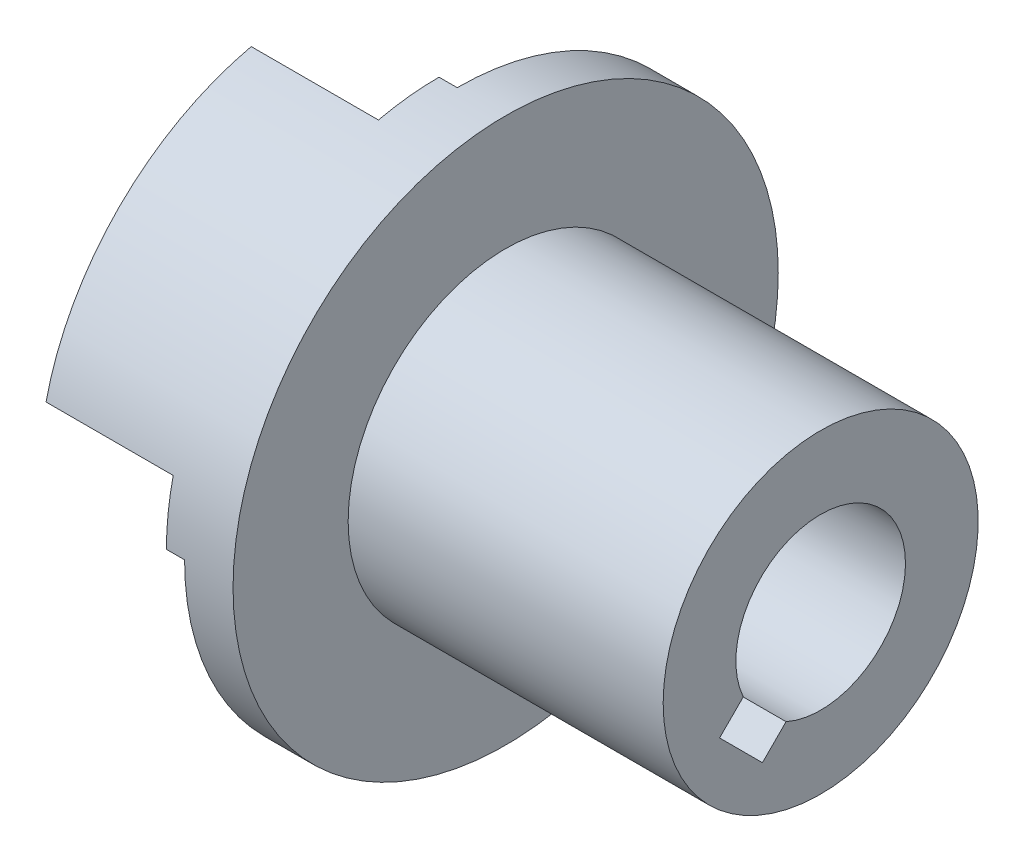
from build123d import *
from build123d.topology import SkipClean

# Parameters (mm, degrees)
EXTRUDE_START            = 1.5
EXTRUDE_4_DEPTH          = 1.5
EXTRUDE_START_2          = 10.5
EXTRUDE_5_DEPTH          = 10.5
PATTERN_CIRCULAR_2_COUNT = 2
CUT_EXTRUDE_3_DEPTH      = 53.692504211


with BuildPart() as part:
    # Эскиз1 → Повернуть1 (revolve)
    with BuildSketch(Plane.XY, mode=Mode.PRIVATE) as revolve_1_sk:
        Polygon((0, 22.5), (0, 7), (30, 7), (30, 13), (4, 13), (4, 22.5), align=None)
    revolve(revolve_1_sk.sketch.rotate(Axis((0, 0, 0), (1, 0, 0)), 90), axis=Axis((0, 0, 0), (1, 0, 0)))

    # Эскиз7 → Бобышка-Вытянуть4 (add)
    with BuildSketch(Plane.ZY.offset(EXTRUDE_START)):
        with BuildLine():
            Line((0, 22.5), (0, 14.142135624))
            Line((0, 14.142135624), (14.142135624, 0))
            Line((14.142135624, 0), (22.5, 0))
            ThreePointArc((22.5, 0), (15.909902577, 15.909902577), (0, 22.5))
        make_face()
    extrude_4 = extrude(amount=-EXTRUDE_4_DEPTH)

    # Эскиз9 → Бобышка-Вытянуть5 (add)
    with BuildSketch(Plane.ZY.offset(1.5).offset(EXTRUDE_START_2)):
        with BuildLine():
            Line((5, 21.937410968), (5, 9.142135624))
            Line((5, 9.142135624), (9.142135624, 5))
            Line((9.142135624, 5), (21.937410968, 5))
            ThreePointArc((21.937410968, 5), (15.909902577, 15.909902577), (5, 21.937410968))
        make_face()
    extrude_5 = extrude(amount=-EXTRUDE_5_DEPTH)

    # Круговой массив2: Бобышка-Вытянуть4, Бобышка-Вытянуть5 ×2 about axis
    with SkipClean():  # the faces are left unmerged after this step: merging them gives an invalid solid
        pattern_circular_2_axis = Axis((0, 0, 0), (1, 0, 0))
        add([extrude_4.rotate(pattern_circular_2_axis, i * 360 / PATTERN_CIRCULAR_2_COUNT) for i in range(1, PATTERN_CIRCULAR_2_COUNT)])
        add([extrude_5.rotate(pattern_circular_2_axis, i * 360 / PATTERN_CIRCULAR_2_COUNT) for i in range(1, PATTERN_CIRCULAR_2_COUNT)])

    # Эскиз10 → Вырез-Вытянуть3 (cut, through all)
    with SkipClean():  # the faces are left unmerged after this step: merging them gives an invalid solid
        with BuildSketch(Plane(origin=(30, 0, 0), x_dir=(0, 0, -1), z_dir=(1, 0, 0))):
            Polygon((1.767766953, -1.767766953), (-1.767766953, 1.767766953), (-8.343860018, -4.808326112), (-4.808326112, -8.343860018), align=None)
        extrude(amount=-CUT_EXTRUDE_3_DEPTH, mode=Mode.SUBTRACT)


solid = part.part
